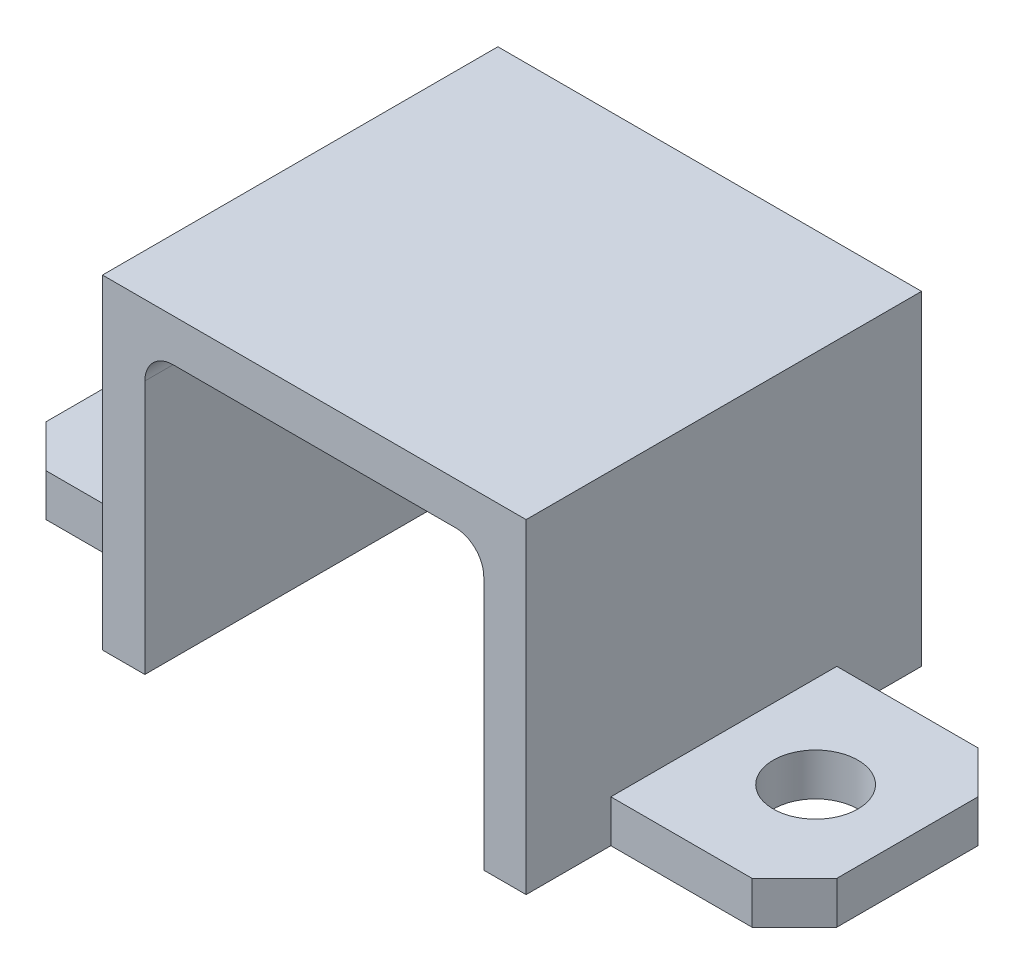
from build123d import *

# Parameters (mm, degrees)
BOSS_EXTRUDE1_DEPTH = 11
SKETCH3_W           = 6.5
SKETCH3_H           = 1.5
CUT_EXTRUDE5_DEPTH  = 3
SKETCH6_R           = 1.5
CUT_EXTRUDE7_DEPTH  = 27.551836095
EXTRUDE_START       = 3
EXTRUDE_1_DEPTH     = 3


with BuildPart() as part:
    # Sketch1 → Boss-Extrude1 (new body)
    with BuildSketch(Plane.XY):
        with BuildLine():
            Line((0.5, 1.5), (0.5, 11.5))
            Line((0.5, 11.5), (15.5, 11.5))
            Line((15.5, 11.5), (15.5, 1.5))
            Line((15.5, 1.5), (22, 1.5))
            Line((22, 1.5), (22, 0))
            Line((22, 0), (14, 0))
            Line((14, 0), (14, 9))
            ThreePointArc((14, 9), (13.707106781, 9.707106781), (13, 10))
            Line((13, 10), (3, 10))
            ThreePointArc((3, 10), (2.292893219, 9.707106781), (2, 9))
            Line((2, 9), (2, 0))
            Line((2, 0), (-6, 0))
            Line((-6, 0), (-6, 1.5))
            Line((-6, 1.5), (0.5, 1.5))
        make_face()
    extrude(amount=BOSS_EXTRUDE1_DEPTH)

    # Sketch3 → Cut-Extrude5 (cut)
    with BuildSketch(Plane.XY.offset(11)):
        with Locations((-2.75, 0.75)):
            Rectangle(SKETCH3_W, SKETCH3_H)
        with Locations((18.75, 0.75)):
            Rectangle(SKETCH3_W, SKETCH3_H)
    extrude(amount=-CUT_EXTRUDE5_DEPTH, mode=Mode.SUBTRACT)

    # Sketch6 → Cut-Extrude7 (cut, through all)
    with BuildSketch(Plane(origin=(0, 1.5, 0), x_dir=(1, 0, 0), z_dir=(0, 1, 0))):
        with Locations(Location((-2.75, -4, 0), (0, 0, 180))):
            Circle(SKETCH6_R)
        with Locations((18.75, -4)):
            Circle(SKETCH6_R)
        Polygon((-6, -1.5), (-4.5, 0), (-6, 0), align=None)
        Polygon((20.5, 0), (22, 0), (22, -1.5), align=None)
        Polygon((22, -6.5), (20.5, -8), (22, -8), align=None)
        Polygon((-4.5, -8), (-6, -8), (-6, -6.5), align=None)
    extrude(amount=-CUT_EXTRUDE7_DEPTH, mode=Mode.SUBTRACT)

    # 草图1 → 凸台-拉伸1 (add)
    with BuildSketch(Plane(origin=(0, 0, 0), x_dir=(-1, 0, 0), z_dir=(0, 0, -1)).offset(EXTRUDE_START)):
        with BuildLine():
            Line((-0.5, 1.5), (-0.5, 0))
            Line((-0.5, 0), (-2, 0))
            Line((-2, 0), (-2, 9))
            ThreePointArc((-2, 9), (-2.292893219, 9.707106781), (-3, 10))
            Line((-3, 10), (-13, 10))
            ThreePointArc((-13, 10), (-13.707106781, 9.707106781), (-14, 9))
            Line((-14, 9), (-14, 0))
            Line((-14, 0), (-15.5, 0))
            Line((-15.5, 0), (-15.5, 1.5))
            Line((-15.5, 1.5), (-15.5, 11.5))
            Line((-15.5, 11.5), (-0.5, 11.5))
            Line((-0.5, 11.5), (-0.5, 1.5))
        make_face()
    extrude(amount=-EXTRUDE_1_DEPTH)


solid = part.part
